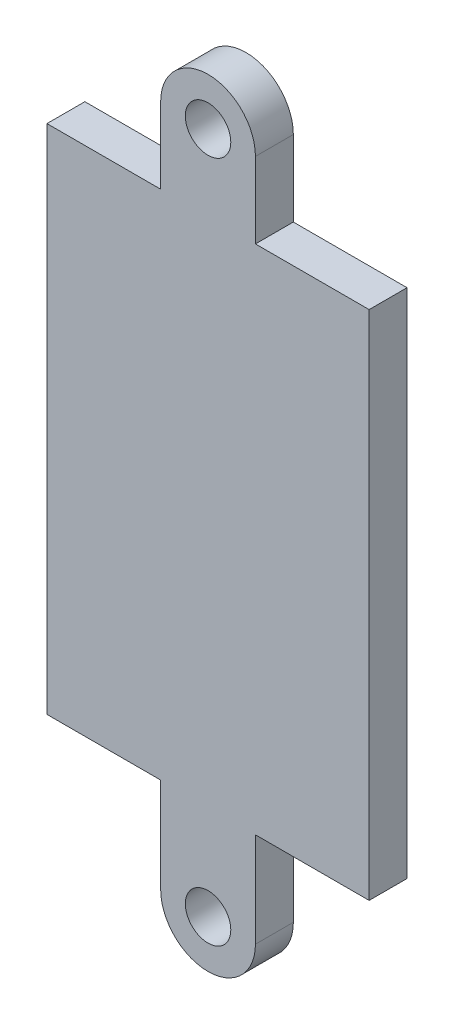
from build123d import *

# Parameters (mm, degrees)
SKETCH1_R           = 3.175
SKETCH1_R_2         = 1.524
SKETCH1_W           = 21.59
SKETCH1_H           = 34.29
BOSS_EXTRUDE1_DEPTH = 2.54


with BuildPart() as part:
    # Sketch1 → Boss-Extrude1 (new body)
    # profile 1 of 5: a face of its own
    with BuildSketch(Plane.XY):
        with Locations((10.795, 39.37)):
            Circle(SKETCH1_R)
        with Locations((10.795, 39.37)):
            Circle(SKETCH1_R_2, mode=Mode.SUBTRACT)
    # profile 2 of 5: a face of its own
    with BuildSketch(Plane.XY):
        with BuildLine():
            ThreePointArc((13.97, 39.37), (10.795, 36.195), (7.62, 39.37))
            Line((7.62, 39.37), (7.62, 34.29))
            Line((7.62, 34.29), (13.97, 34.29))
            Line((13.97, 34.29), (13.97, 39.37))
        make_face()
    # profile 3 of 5: a face of its own
    with BuildSketch(Plane.XY):
        with Locations((10.795, 17.145)):
            Rectangle(SKETCH1_W, SKETCH1_H)
    # profile 4 of 5: a face of its own
    with BuildSketch(Plane.XY):
        with BuildLine():
            Line((13.97, 0), (7.62, 0))
            Line((7.62, 0), (7.62, -6.35))
            ThreePointArc((7.62, -6.35), (10.795, -3.175), (13.97, -6.35))
            Line((13.97, -6.35), (13.97, 0))
        make_face()
    # profile 5 of 5: a face of its own
    with BuildSketch(Plane.XY):
        with Locations((10.795, -6.35)):
            Circle(SKETCH1_R)
        with Locations((10.795, -6.35)):
            Circle(SKETCH1_R_2, mode=Mode.SUBTRACT)
    extrude(amount=BOSS_EXTRUDE1_DEPTH)


solid = part.part
